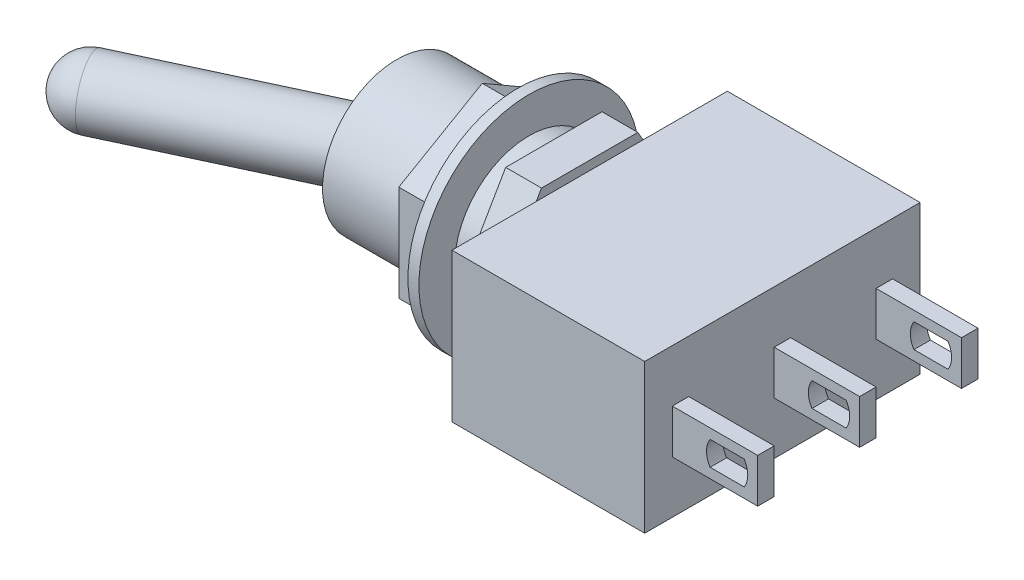
from build123d import *

# Parameters (mm, degrees)
SKETCH1_W           = 8.89
SKETCH1_H           = 6.86
EXTRUDE1_DEPTH      = 6.35
SKETCH2_R           = 3.43
EXTRUDE2_DEPTH      = 8.89
SKETCH4_R           = 2.5
EXTRUDE3_DEPTH      = 0.5
SKETCH5_W           = 0.76
SKETCH5_H           = 2.03
EXTRUDE4_DEPTH      = 3.94
LPATTERN1_COUNT     = 3
LPATTERN1_PITCH     = 4.7
CUT_EXTRUDE1_DEPTH  = 23.912952669
BOSS_EXTRUDE1_DEPTH = 1.651
SKETCH8_W           = 0.508
SKETCH8_H           = 5.08
BOSS_EXTRUDE2_DEPTH = 1.651


with BuildPart() as part:
    # Sketch1 → Extrude1 (new, symmetric)
    with BuildSketch(Plane.XY):
        with Locations((4.445, 0)):
            Rectangle(SKETCH1_W, SKETCH1_H)
    extrude(amount=EXTRUDE1_DEPTH, both=True)

    # Sketch2 → Extrude2 (add)
    with BuildSketch(Plane.ZY):
        with Locations(Location((0, 0, 0), (0, 0, 270))):
            Circle(SKETCH2_R)
    extrude(amount=EXTRUDE2_DEPTH)

    # Sketch4 → Extrude3 (cut)
    with BuildSketch(Plane.ZY.offset(8.89)):
        Circle(SKETCH4_R)
    extrude(amount=-EXTRUDE3_DEPTH, mode=Mode.SUBTRACT)

    # Sketch3 → Revolve3 (revolve)
    with BuildSketch(Plane(origin=(0, 0, 0), x_dir=(1, 0, 0), z_dir=(0, 1, 0))):
        with BuildLine():
            Line((-6.5, 0.5), (-5.882977338, -0.823209369))
            Line((-5.882977338, -0.823209369), (-17.482977338, -6.232378204))
            ThreePointArc((-17.482977338, -6.232378204), (-18.599349409, -6.281120061), (-19.423209369, -5.526191497))
            Line((-19.423209369, -5.526191497), (-6.5, 0.5))
        make_face()
    revolve(axis=Axis((-8.89, 0, 0.614475303), (-0.9063077870366493, 0, 0.4226182617407009)))

    # Sketch5 → Extrude4 (add)
    with BuildSketch(Plane(origin=(8.89, 0, 0), x_dir=(0, 0, -1), z_dir=(1, 0, 0))):
        with Locations((-4.7, 0)):
            Rectangle(SKETCH5_W, SKETCH5_H)
    extrude4 = extrude(amount=EXTRUDE4_DEPTH)

    # LPattern1: Extrude4 ×3
    with Locations(*[(0, 0, -i * LPATTERN1_PITCH) for i in range(1, LPATTERN1_COUNT)]):
        add(extrude4)

    # Sketch6 → Cut-Extrude1 (cut, through all)
    with BuildSketch(Plane.XY.offset(5.08)):
        with BuildLine():
            Line((12.205788302, 0.5578), (10.634811698, 0.5578))
            ThreePointArc((10.634811698, 0.5578), (10.4678, 0), (10.634811698, -0.5578))
            Line((10.634811698, -0.5578), (12.205788302, -0.5578))
            ThreePointArc((12.205788302, -0.5578), (12.3728, 0), (12.205788302, 0.5578))
        make_face()
    extrude(amount=-CUT_EXTRUDE1_DEPTH, mode=Mode.SUBTRACT)

    # Sketch7 → Boss-Extrude1 (add)
    with BuildSketch(Plane.ZY):
        Polygon((-4.443403142, 0), (-2.221701571, -3.8481), (2.221701571, -3.8481), (4.443403142, 0), (2.221701571, 3.8481), (-2.221701571, 3.8481), align=None)
    extrude(amount=BOSS_EXTRUDE1_DEPTH)

    # Sketch8 → Revolve4 (revolve)
    with BuildSketch(Plane(origin=(0, 0, 0), x_dir=(1, 0, 0), z_dir=(0, 1, 0)), mode=Mode.PRIVATE) as revolve4_sk:
        with Locations((-3.048, -2.54)):
            Rectangle(SKETCH8_W, SKETCH8_H)
    revolve(revolve4_sk.sketch.rotate(Axis((-2.794, 0, 0), (-1, 0, 0)), 180), axis=Axis((-2.794, 0, 0), (-1, 0, 0)))

    # Sketch9 → Boss-Extrude2 (add)
    with BuildSketch(Plane.ZY.offset(3.302)):
        Polygon((0, 4.443403142), (-3.8481, 2.221701571), (-3.8481, -2.221701571), (0, -4.443403142), (3.8481, -2.221701571), (3.8481, 2.221701571), align=None)
    extrude(amount=BOSS_EXTRUDE2_DEPTH)


solid = part.part
